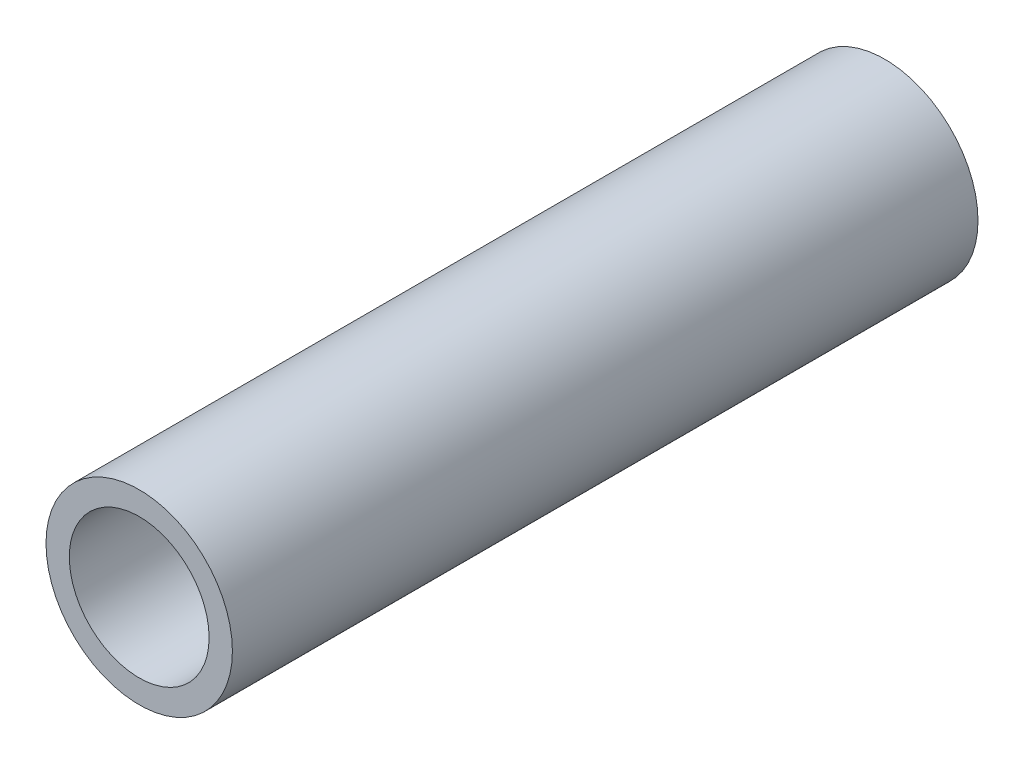
from build123d import *

# Parameters (mm, degrees)
SKETCH1_R           = 20
SKETCH1_R_2         = 15
BOSS_EXTRUDE1_DEPTH = 160


with BuildPart() as part:
    # Sketch1 → Boss-Extrude1 (new body)
    with BuildSketch(Plane.XY):
        Circle(SKETCH1_R)
        Circle(SKETCH1_R_2, mode=Mode.SUBTRACT)
    extrude(amount=BOSS_EXTRUDE1_DEPTH)


solid = part.part
